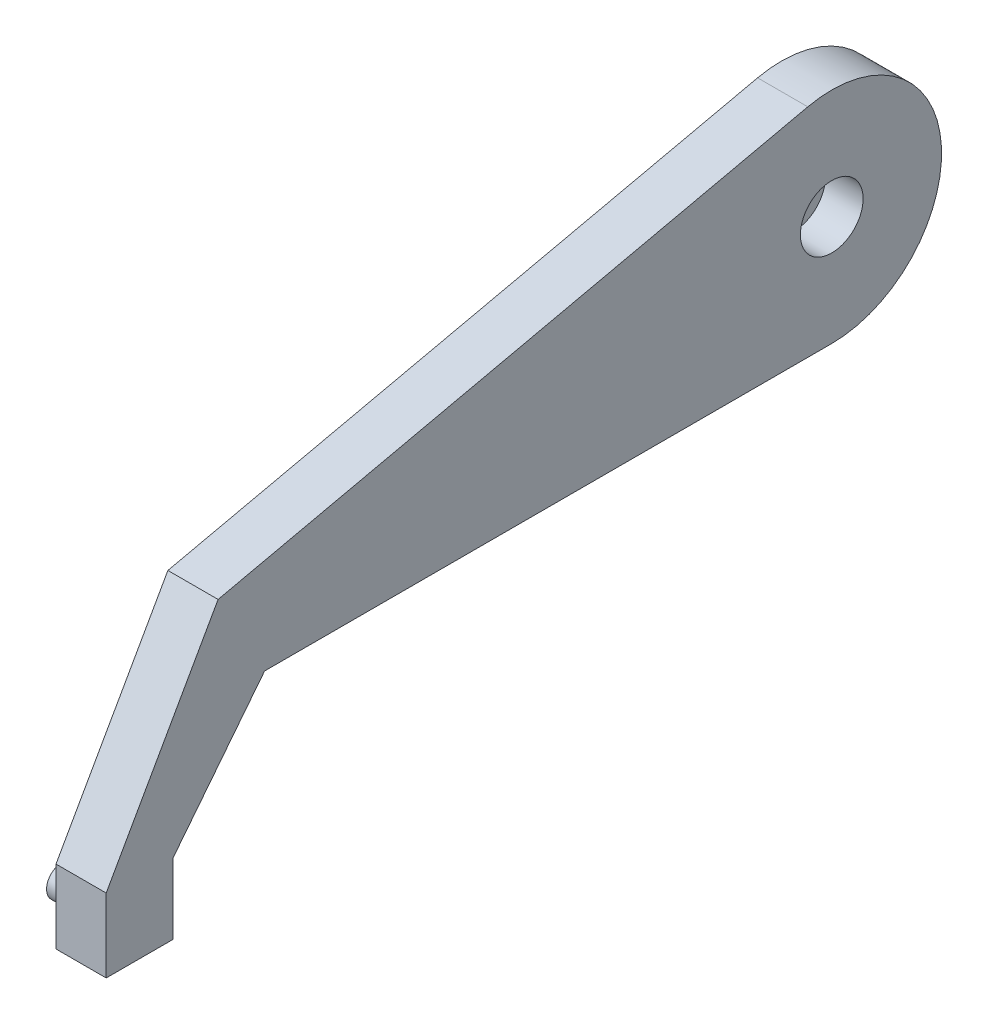
from build123d import *

# Parameters (mm, degrees)
BOSS_EXTRUDE1_DEPTH = 80
SKETCH3_R           = 50
CUT_EXTRUDE1_DEPTH  = 60
SKETCH4_R           = 25
BOSS_EXTRUDE2_DEPTH = 50


with BuildPart() as part:
    # Sketch2 → Boss-Extrude1 (new body)
    with BuildSketch(Plane(origin=(0, 0, 0), x_dir=(0, 0, -1), z_dir=(1, 0, 0))):
        with BuildLine():
            Line((-2112.71125494, 119.084726626), (-1208.916197507, 119.084726626))
            ThreePointArc((-1208.916197507, 119.084726626), (-1034.972119284, 313.279977372), (-1247.075056904, 464.873782041))
            Line((-1247.075056904, 464.873782041), (-2186.803988187, 254.913114055))
            Line((-2186.803988187, 254.913114055), (-2365.101045637, -61.12626206))
            Line((-2365.101045637, -61.12626206), (-2365.101045637, -178.37562801))
            Line((-2365.101045637, -178.37562801), (-2258.835330825, -178.37562801))
            Line((-2258.835330825, -178.37562801), (-2258.835330825, -66.276183237))
            Line((-2258.835330825, -66.276183237), (-2112.71125494, 119.084726626))
        make_face()
    extrude(amount=BOSS_EXTRUDE1_DEPTH)

    # Sketch3 → Cut-Extrude1 (cut)
    with BuildSketch(Plane(origin=(80, 0, 0), x_dir=(0, 0, -1), z_dir=(1, 0, 0))):
        with Locations((-1208.916197507, 294.084726626)):
            Circle(SKETCH3_R)
    extrude(amount=-CUT_EXTRUDE1_DEPTH, mode=Mode.SUBTRACT)

    # Sketch4 → Boss-Extrude2 (add)
    with BuildSketch(Plane.ZY):
        with Locations((2305.101045637, -138.37562801)):
            Circle(SKETCH4_R)
    extrude(amount=BOSS_EXTRUDE2_DEPTH)


solid = part.part
